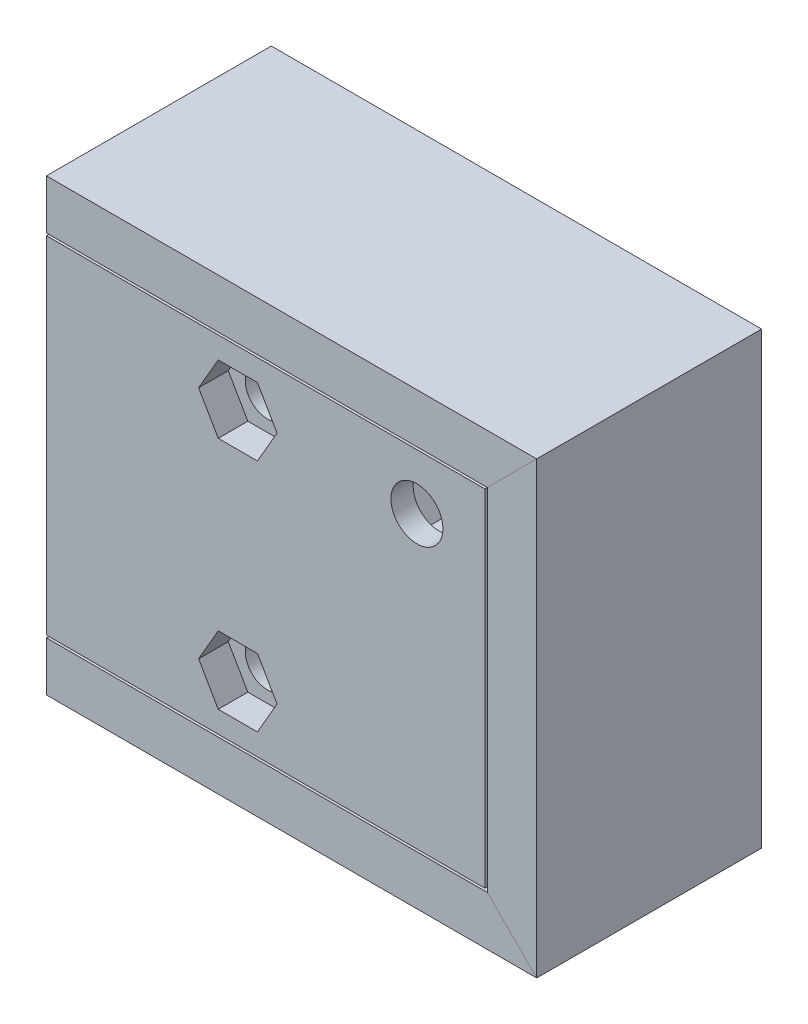
from build123d import *

# Parameters (mm, degrees)
SKETCH1_W           = 35.5
SKETCH1_H           = 28
SKETCH1_R           = 1.8
BOSS_EXTRUDE1_DEPTH = 5
SKETCH2_R           = 2.105
BOSS_EXTRUDE2_DEPTH = 1.8
CUT_EXTRUDE1_DEPTH  = 2.4


with BuildPart() as part:
    # Sketch1 → Boss-Extrude1 (new body)
    with BuildSketch(Plane.XY):
        with Locations((16.75, 13)):
            Rectangle(SKETCH1_W, SKETCH1_H)
        with Locations((14.5, 22.5)):
            Circle(SKETCH1_R, mode=Mode.SUBTRACT)
        with Locations((14.5, 3.5)):
            Circle(SKETCH1_R, mode=Mode.SUBTRACT)
        Polygon((25.304958277, 22.5), (27.152479139, 19.3), (30.847520861, 19.3), (32.695041723, 22.5), (30.847520861, 25.7), (27.152479139, 25.7), align=None, mode=Mode.SUBTRACT)
        Polygon((25.304958277, 3.45), (27.152479139, 0.25), (30.847520861, 0.25), (32.695041723, 3.45), (30.847520861, 6.65), (27.152479139, 6.65), align=None, mode=Mode.SUBTRACT)
    extrude(amount=BOSS_EXTRUDE1_DEPTH)

    # Sketch2 → Boss-Extrude2 (add)
    # profile 1 of 2: a face of its own
    with BuildSketch(Plane.XY.offset(5)):
        Polygon((25.304958277, 22.5), (27.152479139, 19.3), (30.847520861, 19.3), (32.695041723, 22.5), (30.847520861, 25.7), (27.152479139, 25.7), align=None)
        with Locations((29, 22.5)):
            Circle(SKETCH2_R, mode=Mode.SUBTRACT)
    # profile 2 of 2: a face of its own
    with BuildSketch(Plane.XY.offset(5)):
        Polygon((25.304958277, 3.45), (27.152479139, 0.25), (30.847520861, 0.25), (32.695041723, 3.45), (30.847520861, 6.65), (27.152479139, 6.65), align=None)
    extrude(amount=-BOSS_EXTRUDE2_DEPTH)

    # Sketch3 → Cut-Extrude1 (cut)
    with BuildSketch(Plane.XY.offset(5)):
        Polygon((11.324573519, 22.5), (12.91228676, 19.75), (16.08771324, 19.75), (17.675426481, 22.5), (16.08771324, 25.25), (12.91228676, 25.25), align=None)
        Polygon((11.324573519, 3.5), (12.91228676, 0.75), (16.08771324, 0.75), (17.675426481, 3.5), (16.08771324, 6.25), (12.91228676, 6.25), align=None)
    extrude(amount=-CUT_EXTRUDE1_DEPTH, mode=Mode.SUBTRACT)

    # Sweep1: sweep along a curve in space
    with BuildLine() as sweep1_path:
        Line((-1, 27, 2.5), (34.5, 27, 2.5))
        Line((34.5, 27, 2.5), (34.5, -1, 2.5))
        Line((34.5, -1, 2.5), (-1, -1, 2.5))
    # Sketch4 → Sweep1 (sweep)
    with BuildSketch(Plane.ZY.offset(1)):
        Polygon((2.5, 27), (1.5, 27), (1.5, 29), (3.5, 29), (3.5, 27), align=None)
    sweep(path=sweep1_path.line, transition=Transition.RIGHT)


with BuildPart() as body_2:
    # Sweep3: sweep along a curve in space
    with BuildLine() as sweep3_path:
        Line((-1, -3, 2.5), (36.5, -3, 2.5))
        Line((36.5, -3, 2.5), (36.5, 29, 2.5))
        Line((36.5, 29, 2.5), (-1, 29, 2.5))
    # Sketch5 → Sweep3 (sweep)
    with BuildSketch(Plane.ZY.offset(1)):
        Polygon((5, -1.2), (5, -5.2), (-13.2092, -5.2), (-13.2092, -3.2), (-11.2092, -1.2), (1.3, -1.2), (1.3, -3.2), (3.7, -3.2), (3.7, -1.2), align=None)
    sweep(path=sweep3_path.line, transition=Transition.RIGHT)


solid = Compound([part.part, body_2.part])
